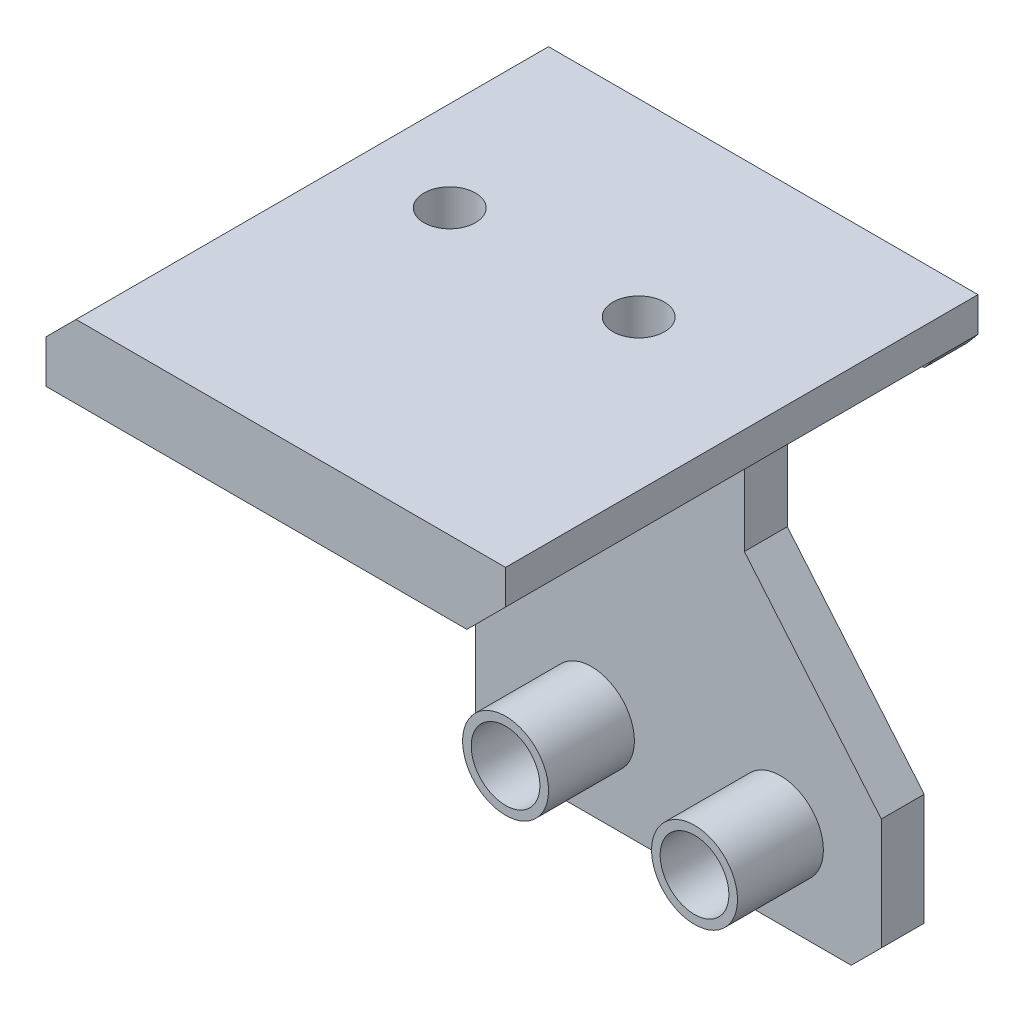
from build123d import *

# Parameters (mm, degrees)
BOSS_EXTRUDE1_DEPTH     = 5
BOSS_EXTRUDE2_DEPTH     = 50
CUT_EXTRUDE1_DEPTH      = 99.333615819
CUT_EXTRUDE1_DEPTH_BACK = 99.333615819
SKETCH3_R               = 3
SKETCH4_R               = 5
SKETCH4_R_2             = 4
BOSS_EXTRUDE3_DEPTH     = 10
SKETCH3_3_R             = 5
SKETCH3_3_R_2           = 3
CUT_EXTRUDE2_DEPTH      = 4
ESQUISSE1_R             = 4
ENL_V_MAT_EXTRU_1_DEPTH = 99.916631564


with BuildPart() as part:
    # Sketch1 → Boss-Extrude1 (new body)
    with BuildSketch(Plane.XY):
        Polygon((52.241350553, -2), (53.5, -0.5), (53.5, 3.5), (3.5, 3.5), (0, 0), (0, -63), (3.5, -66.5), (43.741350553, -66.5), (47.241350553, -63), (47.241350553, -50), (31.298457561, -31), (31.298457561, -21), (47.241350553, -2), align=None)
    extrude(amount=BOSS_EXTRUDE1_DEPTH)

    # Sketch2 → Boss-Extrude2 (add)
    with BuildSketch(Plane.XY.offset(5)):
        Polygon((0, -5), (0, 0), (3.5, 3.5), (53.5, 3.5), (53.5, -0.5), (49, -5), align=None)
    extrude(amount=BOSS_EXTRUDE2_DEPTH)

    # Sketch3 → Cut-Extrude1 (cut, two sides: drawn at the far end of the back side and taken through both)
    with BuildSketch(Plane.XZ.offset(5).offset(-CUT_EXTRUDE1_DEPTH_BACK)):
        with Locations((36, 22)):
            Circle(SKETCH3_R)
        with Locations((14, 22)):
            Circle(SKETCH3_R)
    extrude(amount=CUT_EXTRUDE1_DEPTH + CUT_EXTRUDE1_DEPTH_BACK, mode=Mode.SUBTRACT)

    # Sketch4 → Boss-Extrude3 (add)
    # profile 1 of 2: a face of its own
    with BuildSketch(Plane.XY.offset(5)):
        with Locations((13.5, -56.5)):
            Circle(SKETCH4_R)
        with Locations((13.5, -56.5)):
            Circle(SKETCH4_R_2, mode=Mode.SUBTRACT)
    # profile 2 of 2: a face of its own
    with BuildSketch(Plane.XY.offset(5)):
        with Locations((35.5, -56.5)):
            Circle(SKETCH4_R)
        with Locations((35.5, -56.5)):
            Circle(SKETCH4_R_2, mode=Mode.SUBTRACT)
    extrude(amount=BOSS_EXTRUDE3_DEPTH)

    # Sketch3<3> → Cut-Extrude2 (cut)
    # profile 1 of 2: a face of its own
    with BuildSketch(Plane.XZ.offset(5)):
        with Locations((36, 22)):
            Circle(SKETCH3_3_R)
        with Locations((36, 22)):
            Circle(SKETCH3_3_R_2, mode=Mode.SUBTRACT)
    # profile 2 of 2: a face of its own
    with BuildSketch(Plane.XZ.offset(5)):
        with Locations((14, 22)):
            Circle(SKETCH3_3_R)
        with Locations((14, 22)):
            Circle(SKETCH3_3_R_2, mode=Mode.SUBTRACT)
    extrude(amount=-CUT_EXTRUDE2_DEPTH, mode=Mode.SUBTRACT)

    # Esquisse1 → Enlèv. mat.-Extru.1 (cut, through all)
    with BuildSketch(Plane.XY.offset(5)):
        with Locations((35.5, -56.5)):
            Circle(ESQUISSE1_R)
        with Locations((13.5, -56.5)):
            Circle(ESQUISSE1_R)
    extrude(amount=-ENL_V_MAT_EXTRU_1_DEPTH, mode=Mode.SUBTRACT)


solid = part.part
